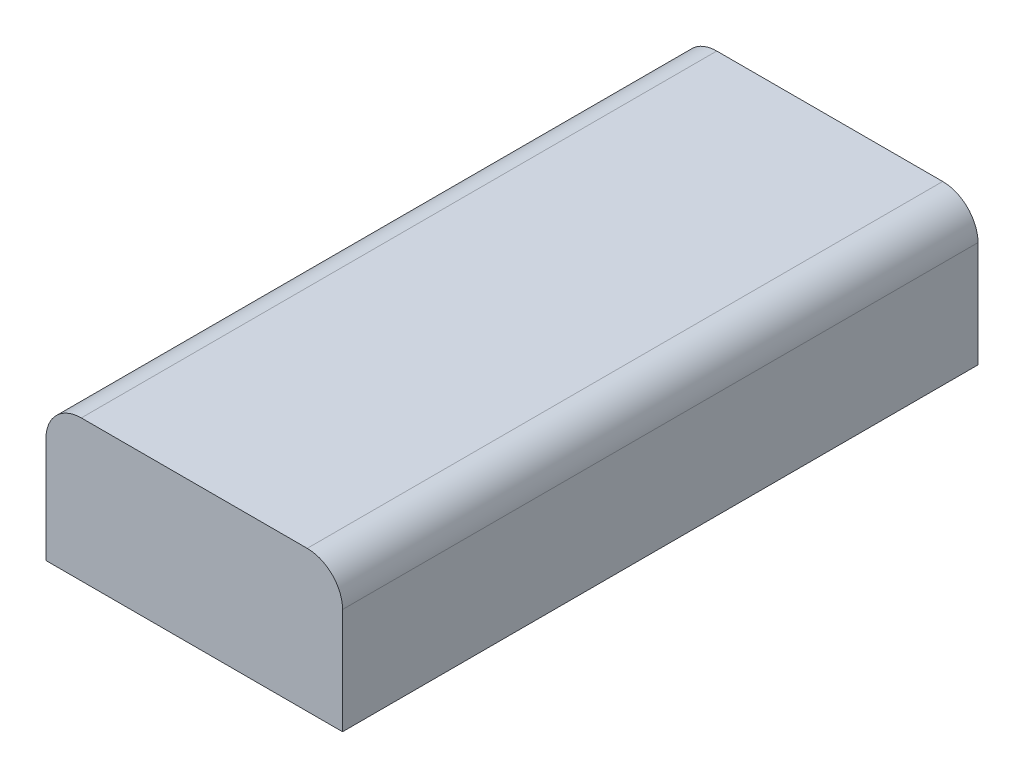
from build123d import *

# Parameters (mm, degrees)
CROQUIS1_W              = 42
CROQUIS1_H              = 20
SALIENTE_EXTRUIR1_DEPTH = 90
CROQUIS2_R              = 1.75
CORTAR_EXTRUIR1_DEPTH   = 3
REDONDEO1_R             = 5
REDONDEO2_R             = 5


with BuildPart() as part:
    # Croquis1 → Saliente-Extruir1 (new body)
    with BuildSketch(Plane.XY):
        with Locations((21, -10)):
            Rectangle(CROQUIS1_W, CROQUIS1_H)
    extrude(amount=SALIENTE_EXTRUIR1_DEPTH)

    # Croquis2 → Cortar-Extruir1 (cut)
    with BuildSketch(Plane.XZ.offset(20)):
        with Locations(Location((8.5, 62, 0), (0, 0, 270))):
            Circle(CROQUIS2_R)
        with Locations(Location((33.5, 62, 0), (0, 0, 270))):
            Circle(CROQUIS2_R)
        with Locations(Location((33.5, 28, 0), (0, 0, 90))):
            Circle(CROQUIS2_R)
        with Locations(Location((8.5, 28, 0), (0, 0, 90))):
            Circle(CROQUIS2_R)
    extrude(amount=-CORTAR_EXTRUIR1_DEPTH, mode=Mode.SUBTRACT)

    # Redondeo1
    redondeo1_edges = [part.edges().sort_by_distance(p)[0] for p in [
        (42, 0, 45),
    ]]
    fillet(redondeo1_edges, radius=REDONDEO1_R)

    # Redondeo2
    redondeo2_edges = [part.edges().sort_by_distance(p)[0] for p in [
        (0, 0, 45),
    ]]
    fillet(redondeo2_edges, radius=REDONDEO2_R)


solid = part.part
